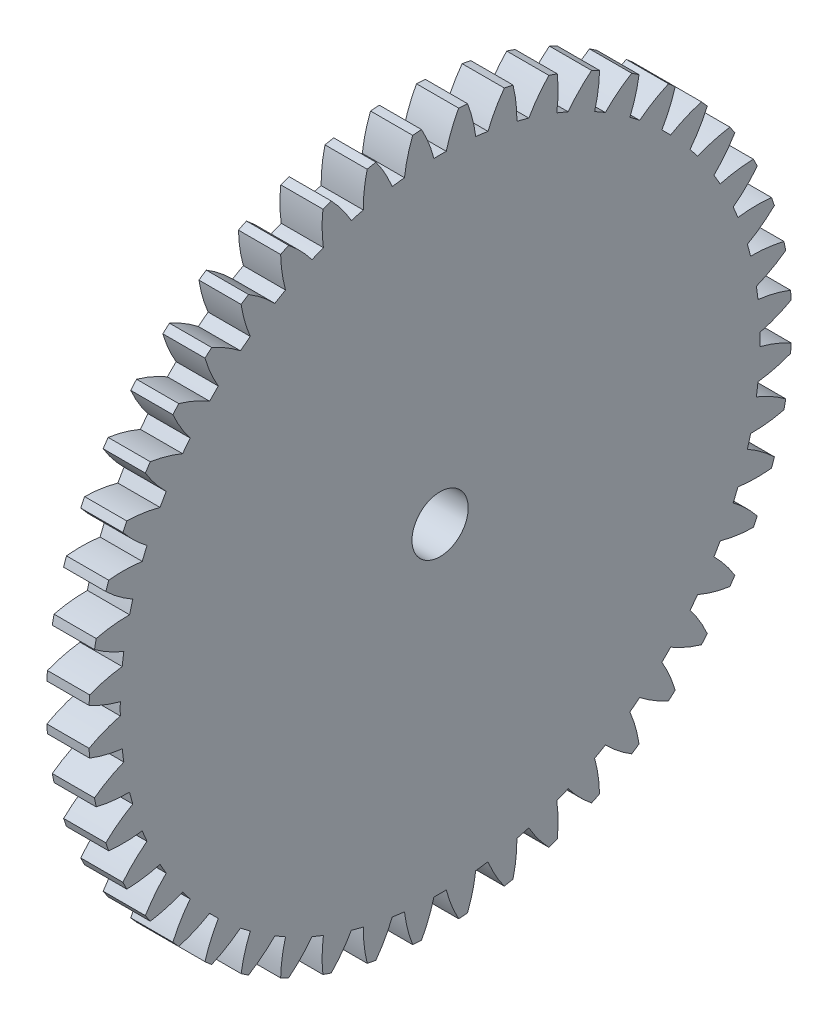
from build123d import *

# Parameters (mm, degrees)
BASPROSKE_W         = 1.5
BASPROSKE_H         = 12.5
TOOTHCUT_DEPTH      = 18.741194999
TEETHCUTS_COUNT     = 48
TEETHCUTS_ANGLE     = 352.5
BORSKE_R            = 1
BORE_DEPTH          = 50.0000508
SKETCH2_R           = 2.25
SKETCH2_R_2         = 1
BOSS_EXTRUDE2_DEPTH = 0.5


with BuildPart() as part:
    # BasProSke → Base-Revolve (revolve)
    with BuildSketch(Plane(origin=(0, 0, 0), x_dir=(1, 0, 0), z_dir=(0, 1, 0)), mode=Mode.PRIVATE) as base_revolve_sk:
        with Locations((0.75, 6.25)):
            Rectangle(BASPROSKE_W, BASPROSKE_H)
    revolve(base_revolve_sk.sketch.rotate(Axis((-10, 0, 0), (1, 0, 0)), 180), axis=Axis((-10, 0, 0), (1, 0, 0)))

    # TooCutSke → ToothCut (cut, through all)
    with BuildSketch(Plane(origin=(0, 0, 0), x_dir=(0, 0, -1), z_dir=(1, 0, 0))):
        with BuildLine():
            ThreePointArc((0.219631136, 11.371879271), (0, 11.374), (-0.219631136, 11.371879271))
            ThreePointArc((-0.219631136, 11.371879271), (-0.410348592, 11.954092425), (-0.673672617, 12.5072703))
            ThreePointArc((-0.673672617, 12.5072703), (0, 12.5254), (0.673672617, 12.5072703))
            ThreePointArc((0.673672617, 12.5072703), (0.410348592, 11.954092425), (0.219631136, 11.371879271))
        make_face()
    toothcut = extrude(amount=TOOTHCUT_DEPTH, mode=Mode.SUBTRACT)

    # TeethCuts: ToothCut ×48 about axis
    teethcuts_axis = Axis((-10, 0, 0), (1, 0, 0))
    for i in range(1, TEETHCUTS_COUNT):
        add(toothcut.rotate(teethcuts_axis, i * TEETHCUTS_ANGLE / (TEETHCUTS_COUNT - 1)), mode=Mode.SUBTRACT)

    # BorSke → Bore (cut, symmetric)
    with BuildSketch(Plane(origin=(0, 0, 0), x_dir=(0, 0, -1), z_dir=(1, 0, 0))):
        with Locations(Location((0, 0, 0), (0, 0, 180))):
            Circle(BORSKE_R)
    extrude(amount=BORE_DEPTH, both=True, mode=Mode.SUBTRACT)

    # Sketch2 → Boss-Extrude2 (add)
    with BuildSketch(Plane.ZY):
        with Locations(Location((0, 0, 0), (0, 0, 180))):
            Circle(SKETCH2_R)
        Circle(SKETCH2_R_2, mode=Mode.SUBTRACT)
    extrude(amount=BOSS_EXTRUDE2_DEPTH)


solid = part.part
